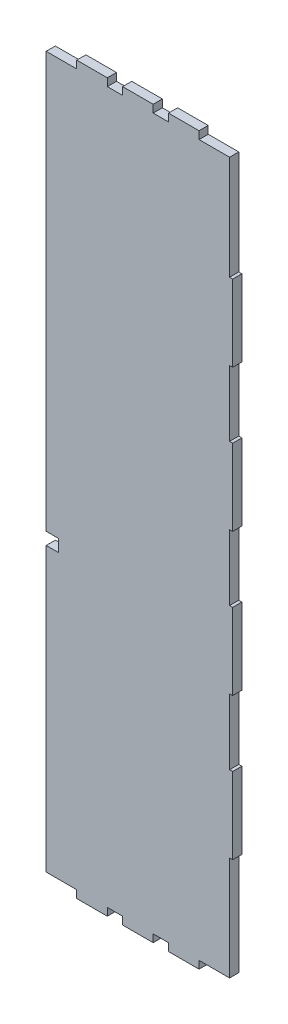
from build123d import *

# Parameters (mm, degrees)
SKETCH1_W           = 120
SKETCH1_H           = 465
BOSS_EXTRUDE1_DEPTH = 6
SKETCH4_W           = 20
SKETCH4_H           = 10
SKETCH4_W_2         = 4
SKETCH4_H_2         = 50
BOSS_EXTRUDE2_DEPTH = 6
SKETCH5_W           = 8
SKETCH5_H           = 8
CUT_EXTRUDE1_DEPTH  = 10


with BuildPart() as part:
    # Sketch1 → Boss-Extrude1 (new body)
    with BuildSketch(Plane.XY):
        Rectangle(SKETCH1_W, SKETCH1_H)
    extrude(amount=BOSS_EXTRUDE1_DEPTH)

    # Sketch4 → Boss-Extrude2 (add)
    with BuildSketch(Plane.XY.offset(6)):
        with Locations((-30, 232.5)):
            Rectangle(SKETCH4_W, SKETCH4_H)
        with Locations((0, 232.5)):
            Rectangle(SKETCH4_W, SKETCH4_H)
        with Locations((30, 232.5)):
            Rectangle(SKETCH4_W, SKETCH4_H)
        with Locations((-30, -232.5)):
            Rectangle(SKETCH4_W, SKETCH4_H)
        with Locations((0, -232.5)):
            Rectangle(SKETCH4_W, SKETCH4_H)
        with Locations((30, -232.5)):
            Rectangle(SKETCH4_W, SKETCH4_H)
        with Locations((60, 139.5)):
            Rectangle(SKETCH4_W_2, SKETCH4_H_2)
        with Locations((60, 46.5)):
            Rectangle(SKETCH4_W_2, SKETCH4_H_2)
        with Locations((60, -46.5)):
            Rectangle(SKETCH4_W_2, SKETCH4_H_2)
        with Locations((60, -139.5)):
            Rectangle(SKETCH4_W_2, SKETCH4_H_2)
    extrude(amount=-BOSS_EXTRUDE2_DEPTH)

    # Sketch5 → Cut-Extrude1 (cut)
    with BuildSketch(Plane.XY.offset(6)):
        with Locations((-56, -43.434460059)):
            Rectangle(SKETCH5_W, SKETCH5_H)
    extrude(amount=-CUT_EXTRUDE1_DEPTH, mode=Mode.SUBTRACT)


solid = part.part
